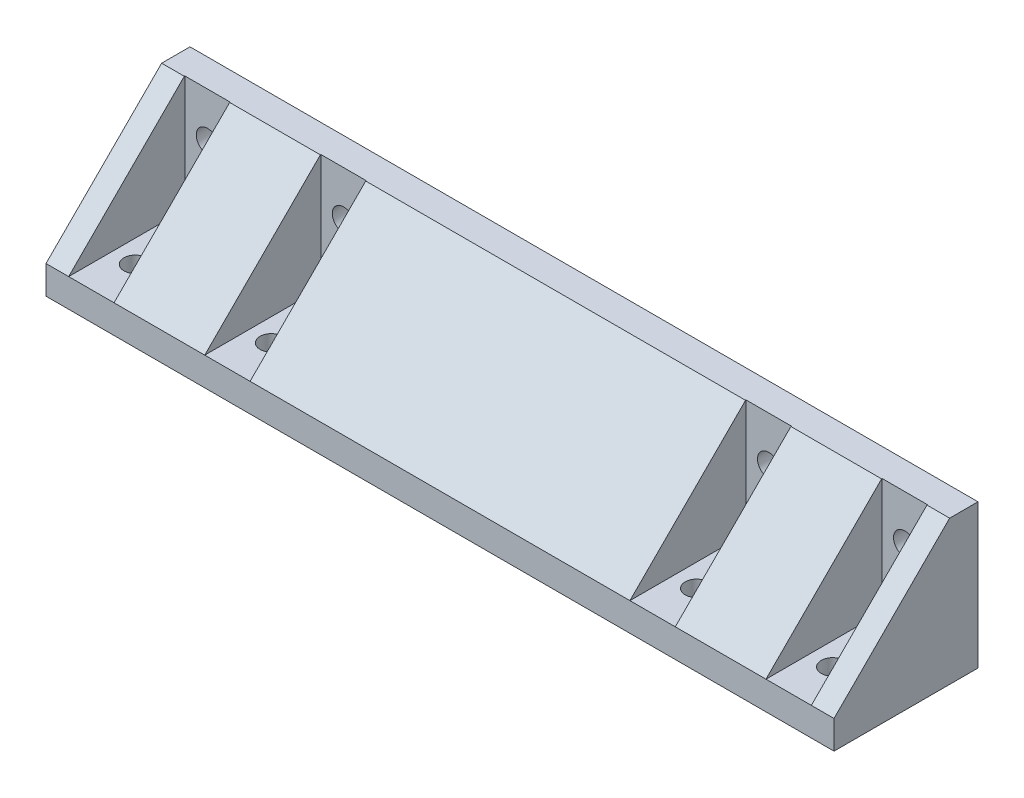
from build123d import *

# Parameters (mm, degrees)
BOSS_EXTRUDE1_DEPTH     = 5
SKETCH3_W               = 139
SKETCH3_H               = 5
BOSS_EXTRUDE2_DEPTH     = 20.4
SKETCH4_W               = 139
SKETCH4_H               = 20.4
BOSS_EXTRUDE3_DEPTH     = 20.5
CUT_EXTRUDE1_DEPTH      = 144.584156508
CUT_EXTRUDE1_DEPTH_BACK = 144.584156508
SKETCH7_W               = 8
SKETCH7_H               = 20.4
CUT_EXTRUDE2_DEPTH      = 20.5
SKETCH8_R               = 2
CUT_EXTRUDE3_DEPTH      = 10


with BuildPart() as part:
    # Sketch1 → Boss-Extrude1 (new body)
    with BuildSketch(Plane(origin=(0, 0, 0), x_dir=(1, 0, 0), z_dir=(0, 1, 0))):
        with BuildLine():
            Line((0, 15.75), (0, 7.75))
            Line((0, 7.75), (6, 7.75))
            ThreePointArc((6, 7.75), (8, 9.75), (10, 7.75))
            Line((10, 7.75), (30, 7.75))
            ThreePointArc((30, 7.75), (32, 9.75), (34, 7.75))
            Line((34, 7.75), (105, 7.75))
            ThreePointArc((105, 7.75), (107, 9.75), (109, 7.75))
            Line((109, 7.75), (129, 7.75))
            ThreePointArc((129, 7.75), (131, 9.75), (133, 7.75))
            Line((133, 7.75), (139, 7.75))
            Line((139, 7.75), (139, 15.75))
            Line((139, 15.75), (133, 15.75))
            ThreePointArc((133, 15.75), (131, 13.75), (129, 15.75))
            Line((129, 15.75), (109, 15.75))
            ThreePointArc((109, 15.75), (107, 13.75), (105, 15.75))
            Line((105, 15.75), (34, 15.75))
            ThreePointArc((34, 15.75), (32, 13.75), (30, 15.75))
            Line((30, 15.75), (24, 15.75))
            Line((24, 15.75), (16, 15.75))
            Line((16, 15.75), (10, 15.75))
            ThreePointArc((10, 15.75), (8, 13.75), (6, 15.75))
            Line((6, 15.75), (0, 15.75))
        make_face()
        with BuildLine():
            Line((0, 7.75), (0, 0))
            Line((0, 0), (139, 0))
            Line((139, 0), (139, 7.75))
            Line((139, 7.75), (133, 7.75))
            ThreePointArc((133, 7.75), (131, 5.75), (129, 7.75))
            Line((129, 7.75), (109, 7.75))
            ThreePointArc((109, 7.75), (107, 5.75), (105, 7.75))
            Line((105, 7.75), (34, 7.75))
            ThreePointArc((34, 7.75), (32, 5.75), (30, 7.75))
            Line((30, 7.75), (10, 7.75))
            ThreePointArc((10, 7.75), (8, 5.75), (6, 7.75))
            Line((6, 7.75), (0, 7.75))
        make_face()
        with BuildLine():
            Line((0, 20.4), (0, 15.75))
            Line((0, 15.75), (6, 15.75))
            ThreePointArc((6, 15.75), (8, 17.75), (10, 15.75))
            Line((10, 15.75), (16, 15.75))
            Line((16, 15.75), (24, 15.75))
            Line((24, 15.75), (30, 15.75))
            ThreePointArc((30, 15.75), (32, 17.75), (34, 15.75))
            Line((34, 15.75), (105, 15.75))
            ThreePointArc((105, 15.75), (107, 17.75), (109, 15.75))
            Line((109, 15.75), (129, 15.75))
            ThreePointArc((129, 15.75), (131, 17.75), (133, 15.75))
            Line((133, 15.75), (139, 15.75))
            Line((139, 15.75), (139, 20.4))
            Line((139, 20.4), (0, 20.4))
        make_face()
        Polygon((0, 23.75), (0, 20.4), (139, 20.4), (139, 25.4), (0, 25.4), align=None)
    extrude(amount=BOSS_EXTRUDE1_DEPTH)

    # Sketch3 → Boss-Extrude2 (add)
    with BuildSketch(Plane(origin=(0, 5, 0), x_dir=(1, 0, 0), z_dir=(0, 1, 0))):
        with Locations((69.5, 22.9)):
            Rectangle(SKETCH3_W, SKETCH3_H)
    extrude(amount=BOSS_EXTRUDE2_DEPTH)

    # Sketch4 → Boss-Extrude3 (add)
    with BuildSketch(Plane(origin=(0, 5, 0), x_dir=(1, 0, 0), z_dir=(0, 1, 0))):
        with Locations((69.5, 10.2)):
            Rectangle(SKETCH4_W, SKETCH4_H)
    extrude(amount=BOSS_EXTRUDE3_DEPTH)

    # Sketch5 → Cut-Extrude1 (cut, two sides: drawn at the far end of the back side and taken through both)
    with BuildSketch(Plane(origin=(139, 0, 0), x_dir=(0, 0, -1), z_dir=(1, 0, 0)).offset(-CUT_EXTRUDE1_DEPTH_BACK)):
        Polygon((0, 5), (20.4, 25.4), (20.4, 25.5), (0, 25.5), align=None)
    extrude(amount=CUT_EXTRUDE1_DEPTH + CUT_EXTRUDE1_DEPTH_BACK, mode=Mode.SUBTRACT)

    # Sketch7 → Cut-Extrude2 (cut)
    with BuildSketch(Plane.XY):
        with Locations((8, 15.2)):
            Rectangle(SKETCH7_W, SKETCH7_H)
        with Locations((32, 15.2)):
            Rectangle(SKETCH7_W, SKETCH7_H)
        with Locations((107, 15.2)):
            Rectangle(SKETCH7_W, SKETCH7_H)
        with Locations((131, 15.2)):
            Rectangle(SKETCH7_W, SKETCH7_H)
    extrude(amount=-CUT_EXTRUDE2_DEPTH, mode=Mode.SUBTRACT)

    # Sketch8 → Cut-Extrude3 (cut)
    with BuildSketch(Plane.XY.offset(-20.5)):
        with Locations((8, 17.4)):
            Circle(SKETCH8_R)
        with Locations((32, 17.4)):
            Circle(SKETCH8_R)
        with Locations((107, 17.4)):
            Circle(SKETCH8_R)
        with Locations((131, 17.4)):
            Circle(SKETCH8_R)
    extrude(amount=-CUT_EXTRUDE3_DEPTH, mode=Mode.SUBTRACT)


solid = part.part
